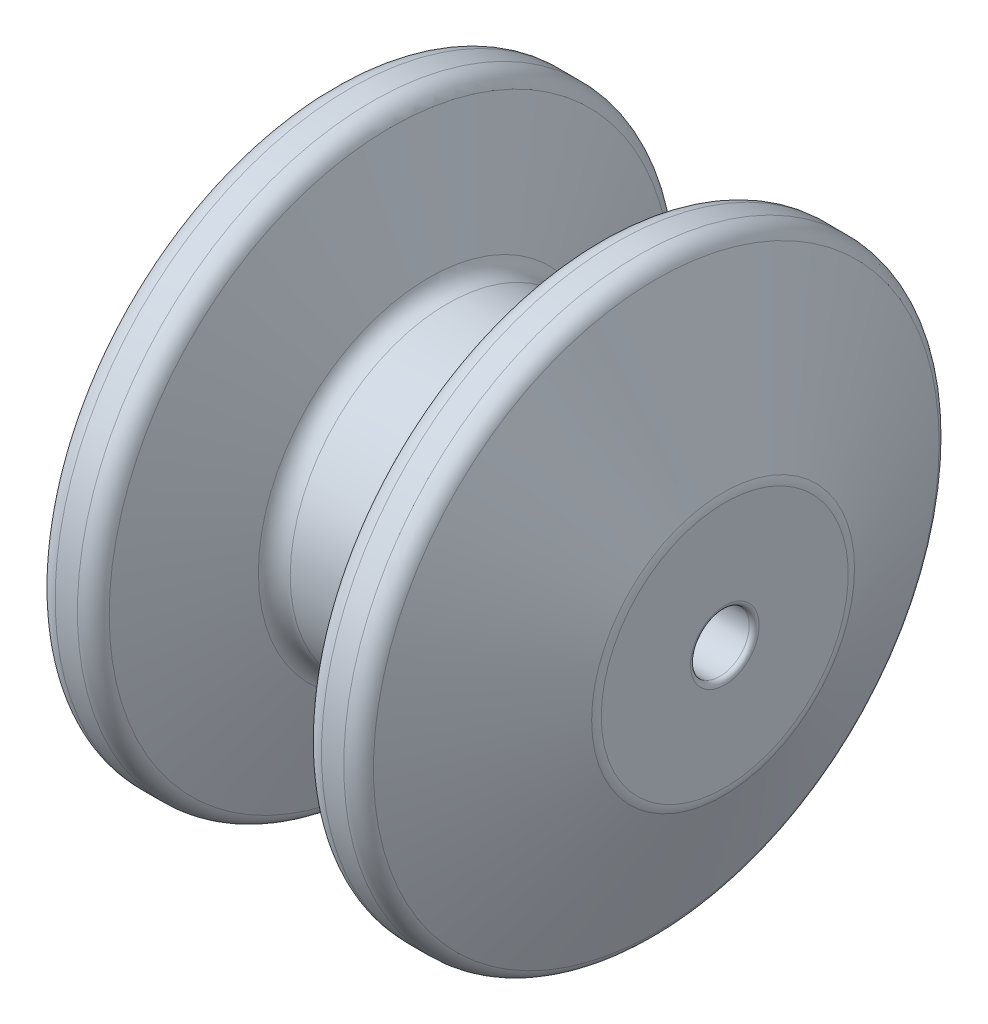
from build123d import *

# Parameters (mm, degrees)
REDONDEO2_R = 2
REDONDEO3_R = 0.5


with BuildPart() as part:
    # Croquis1 → Revolución1 (revolve)
    with BuildSketch(Plane.XY, mode=Mode.PRIVATE) as revoluci_n1_sk:
        Polygon((-16, 30), (-11, 30), (-6.179413414, 16), (0, 16), (6.179413414, 16), (11, 30), (16, 30), (23.5, 13), (23.5, 3), (-23.5, 3), (-23.5, 13), align=None)
    revolve(revoluci_n1_sk.sketch.rotate(Axis((-29.031578947, 0, 0), (1, 0, 0)), 90), axis=Axis((-29.031578947, 0, 0), (1, 0, 0)))

    # Redondeo2
    redondeo2_edges = [part.edges().sort_by_distance(p)[0] for p in [
        (-16, 0, -30),
        (-23.5, 0, -13),
        (23.5, 0, -13),
        (16, 0, -30),
        (11, 0, -30),
        (6.179413414, 0, -16),
        (-6.179413414, 0, -16),
        (-11, 0, -30),
    ]]
    fillet(redondeo2_edges, radius=REDONDEO2_R)

    # Redondeo3
    redondeo3_edges = [part.edges().sort_by_distance(p)[0] for p in [
        (-23.5, 0, -3),
        (23.5, 0, -3),
    ]]
    fillet(redondeo3_edges, radius=REDONDEO3_R)


solid = part.part
